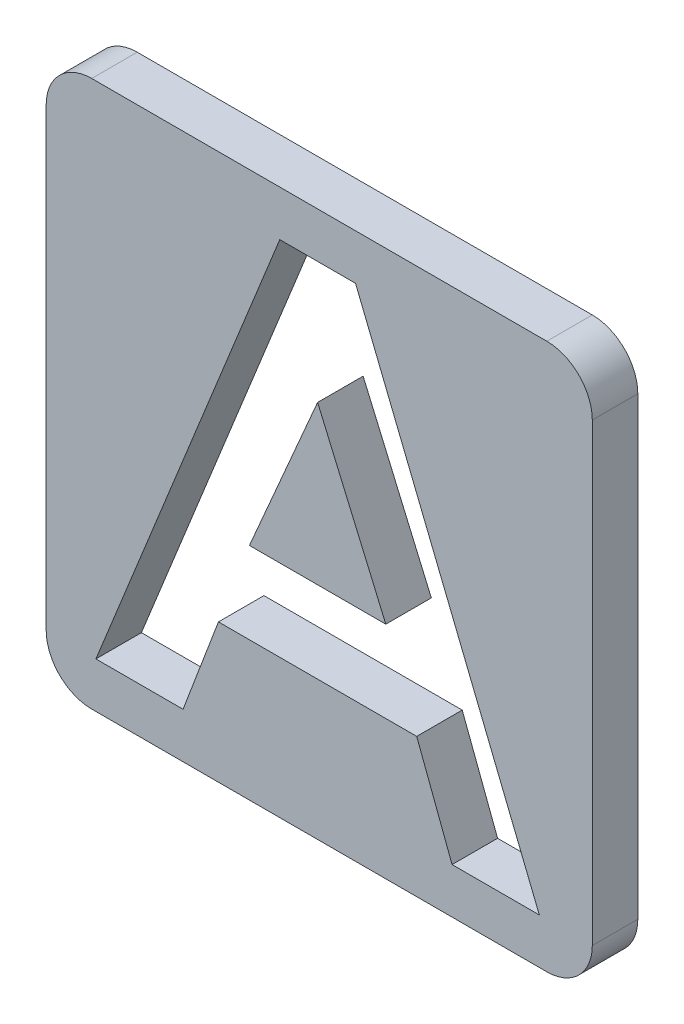
from build123d import *

# Parameters (mm, degrees)
BOSS_EXTRUDE1_DEPTH = 10
CUT_EXTRUDE14_DEPTH = 10


with BuildPart() as part:
    # Sketch1 → Boss-Extrude1 (new body)
    with BuildSketch(Plane.XY):
        with BuildLine():
            Line((-50, 60), (50, 60))
            ThreePointArc((50, 60), (57.071067812, 57.071067812), (60, 50))
            Line((60, 50), (60, -50))
            ThreePointArc((60, -50), (57.071067812, -57.071067812), (50, -60))
            Line((50, -60), (-50, -60))
            ThreePointArc((-50, -60), (-57.071067812, -57.071067812), (-60, -50))
            Line((-60, -50), (-60, 50))
            ThreePointArc((-60, 50), (-57.071067812, 57.071067812), (-50, 60))
        make_face()
    extrude(amount=BOSS_EXTRUDE1_DEPTH)

    # Sketch2 → Cut-Extrude14 (cut)
    with BuildSketch(Plane.XY.offset(10)):
        Polygon((-8.672275641, 50), (7.974358974, 50), (48.358974359, -50), (29.188301282, -50), (21.415865385, -29.487179487), (-22.153846154, -29.487179487), (-29.926282051, -50), (-49.076923077, -50), align=None)
        Polygon((-0.358974359, 23.177083333), (-15.342948718, -11.538461538), (14.625, -11.538461538), align=None, mode=Mode.SUBTRACT)
    extrude(amount=-CUT_EXTRUDE14_DEPTH, mode=Mode.SUBTRACT)


with BuildPart() as cut_extrude14_piece_1:
    # of the separate pieces the step leaves, piece 1, a body of its own (cut_extrude14_pieces)
    add(part.part.solids().sort_by_distance((-50, 60, 0))[0])


with BuildPart() as cut_extrude14_piece_2:
    # of the separate pieces the step leaves, piece 2, a body of its own (cut_extrude14_pieces)
    add(part.part.solids().sort_by_distance((-0.358974359, 23.177083333, 0))[0])


solid = Compound([cut_extrude14_piece_1.part, cut_extrude14_piece_2.part])
